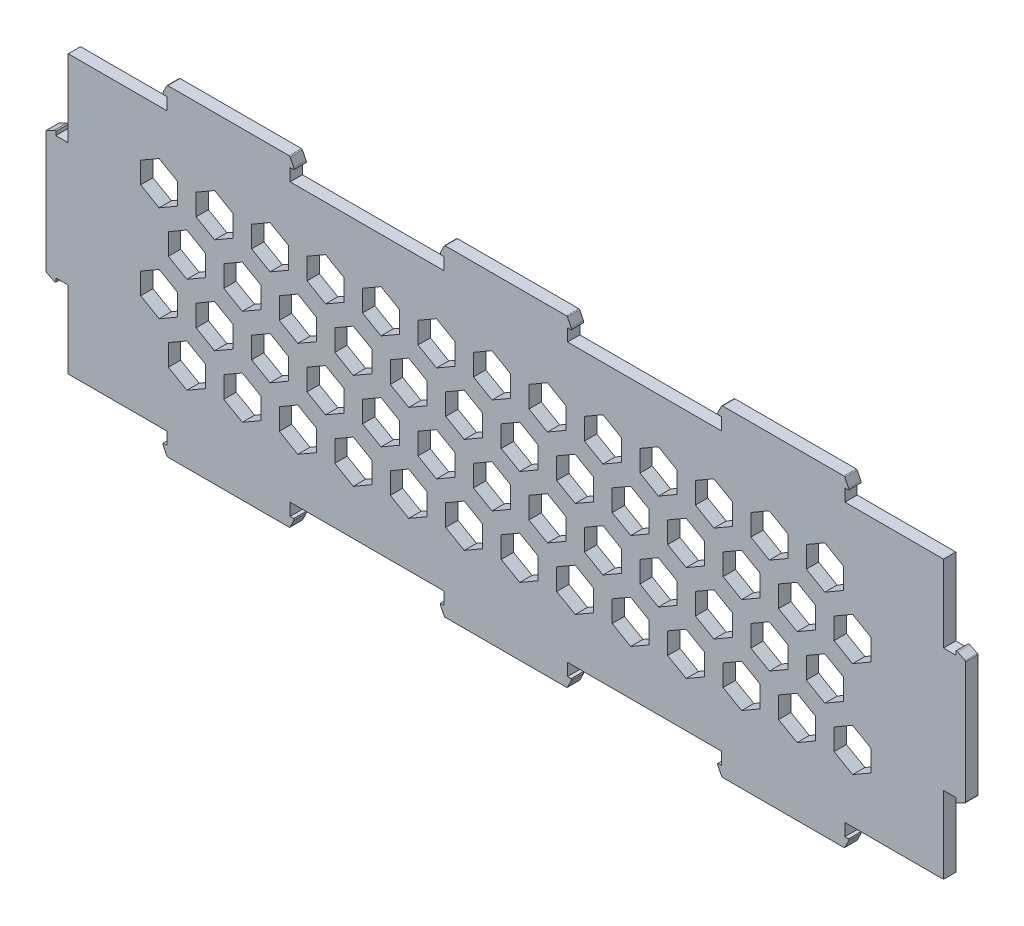
from build123d import *

# Parameters (mm, degrees)
BOSS_EXTRUDE1_DEPTH     = 2
ENL_V_MAT_EXTRU_1_DEPTH = 148.934343545


with BuildPart() as part:
    # Sketch1 → Boss-Extrude1 (new body)
    with BuildSketch(Plane.XY):
        with BuildLine():
            Line((0, 10), (0, 22.5))
            Line((0, 22.5), (16, 22.5))
            Line((16, 22.5), (16, 24.5))
            Line((16, 24.5), (15.4, 24.5))
            ThreePointArc((15.4, 24.5), (15.364589803, 24.65), (15.4, 24.8))
            Line((15.4, 24.8), (16, 26))
            ThreePointArc((16, 26), (16.066697747, 26.072982477), (16.161803399, 26.1))
            Line((16.161803399, 26.1), (35.838196601, 26.1))
            ThreePointArc((35.838196601, 26.1), (35.933302253, 26.072982477), (36, 26))
            Line((36, 26), (36.6, 24.8))
            ThreePointArc((36.6, 24.8), (36.635410197, 24.65), (36.6, 24.5))
            Line((36.6, 24.5), (36, 24.5))
            Line((36, 24.5), (36, 22.5))
            Line((36, 22.5), (61, 22.5))
            Line((61, 22.5), (61, 24.5))
            Line((61, 24.5), (60.4, 24.5))
            ThreePointArc((60.4, 24.5), (60.364589803, 24.65), (60.4, 24.8))
            Line((60.4, 24.8), (61, 26))
            ThreePointArc((61, 26), (61.066697747, 26.072982477), (61.161803399, 26.1))
            Line((61.161803399, 26.1), (80.838196601, 26.1))
            ThreePointArc((80.838196601, 26.1), (80.933302253, 26.072982477), (81, 26))
            Line((81, 26), (81.6, 24.8))
            ThreePointArc((81.6, 24.8), (81.635410197, 24.65), (81.6, 24.5))
            Line((81.6, 24.5), (81, 24.5))
            Line((81, 24.5), (81, 22.5))
            Line((81, 22.5), (106, 22.5))
            Line((106, 22.5), (106, 24.5))
            Line((106, 24.5), (105.4, 24.5))
            ThreePointArc((105.4, 24.5), (105.364589803, 24.65), (105.4, 24.8))
            Line((105.4, 24.8), (106, 26))
            ThreePointArc((106, 26), (106.066697747, 26.072982477), (106.161803399, 26.1))
            Line((106.161803399, 26.1), (125.838196601, 26.1))
            ThreePointArc((125.838196601, 26.1), (125.933302253, 26.072982477), (126, 26))
            Line((126, 26), (126.6, 24.8))
            ThreePointArc((126.6, 24.8), (126.635410197, 24.65), (126.6, 24.5))
            Line((126.6, 24.5), (126, 24.5))
            Line((126, 24.5), (126, 22.5))
            Line((126, 22.5), (142, 22.5))
            Line((142, 22.5), (142, 10))
            Line((142, 10), (144, 10))
            Line((144, 10), (144, 10.6))
            ThreePointArc((144, 10.6), (144.15, 10.635410197), (144.3, 10.6))
            Line((144.3, 10.6), (145.5, 10))
            ThreePointArc((145.5, 10), (145.572982477, 9.933302253), (145.6, 9.838196601))
            Line((145.6, 9.838196601), (145.6, -9.838196601))
            ThreePointArc((145.6, -9.838196601), (145.572982477, -9.933302253), (145.5, -10))
            Line((145.5, -10), (144.3, -10.6))
            ThreePointArc((144.3, -10.6), (144.15, -10.635410197), (144, -10.6))
            Line((144, -10.6), (144, -10))
            Line((144, -10), (142, -10))
            Line((142, -10), (142, -22.5))
            Line((142, -22.5), (126, -22.5))
            Line((126, -22.5), (126, -24.5))
            Line((126, -24.5), (126.6, -24.5))
            ThreePointArc((126.6, -24.5), (126.635410197, -24.65), (126.6, -24.8))
            Line((126.6, -24.8), (126, -26))
            ThreePointArc((126, -26), (125.933302253, -26.072982477), (125.838196601, -26.1))
            Line((125.838196601, -26.1), (106.161803399, -26.1))
            ThreePointArc((106.161803399, -26.1), (106.066697747, -26.072982477), (106, -26))
            Line((106, -26), (105.4, -24.8))
            ThreePointArc((105.4, -24.8), (105.364589803, -24.65), (105.4, -24.5))
            Line((105.4, -24.5), (106, -24.5))
            Line((106, -24.5), (106, -22.5))
            Line((106, -22.5), (81, -22.5))
            Line((81, -22.5), (81, -24.5))
            Line((81, -24.5), (81.6, -24.5))
            ThreePointArc((81.6, -24.5), (81.635410197, -24.65), (81.6, -24.8))
            Line((81.6, -24.8), (81, -26))
            ThreePointArc((81, -26), (80.933302253, -26.072982477), (80.838196601, -26.1))
            Line((80.838196601, -26.1), (61.161803399, -26.1))
            ThreePointArc((61.161803399, -26.1), (61.066697747, -26.072982477), (61, -26))
            Line((61, -26), (60.4, -24.8))
            ThreePointArc((60.4, -24.8), (60.364589803, -24.65), (60.4, -24.5))
            Line((60.4, -24.5), (61, -24.5))
            Line((61, -24.5), (61, -22.5))
            Line((61, -22.5), (36, -22.5))
            Line((36, -22.5), (36, -24.5))
            Line((36, -24.5), (36.6, -24.5))
            ThreePointArc((36.6, -24.5), (36.635410197, -24.65), (36.6, -24.8))
            Line((36.6, -24.8), (36, -26))
            ThreePointArc((36, -26), (35.933302253, -26.072982477), (35.838196601, -26.1))
            Line((35.838196601, -26.1), (16.161803399, -26.1))
            ThreePointArc((16.161803399, -26.1), (16.066697747, -26.072982477), (16, -26))
            Line((16, -26), (15.4, -24.8))
            ThreePointArc((15.4, -24.8), (15.364589803, -24.65), (15.4, -24.5))
            Line((15.4, -24.5), (16, -24.5))
            Line((16, -24.5), (16, -22.5))
            Line((16, -22.5), (0, -22.5))
            Line((0, -22.5), (0, -10))
            Line((0, -10), (-2, -10))
            Line((-2, -10), (-2, -10.6))
            ThreePointArc((-2, -10.6), (-2.15, -10.635410197), (-2.3, -10.6))
            Line((-2.3, -10.6), (-3.5, -10))
            ThreePointArc((-3.5, -10), (-3.572982477, -9.933302253), (-3.6, -9.838196601))
            Line((-3.6, -9.838196601), (-3.6, 9.838196601))
            ThreePointArc((-3.6, 9.838196601), (-3.572982477, 9.933302253), (-3.5, 10))
            Line((-3.5, 10), (-2.3, 10.6))
            ThreePointArc((-2.3, 10.6), (-2.15, 10.635410197), (-2, 10.6))
            Line((-2, 10.6), (-2, 10))
            Line((-2, 10), (0, 10))
        make_face()
    extrude(amount=BOSS_EXTRUDE1_DEPTH)

    # Esquisse1 → Enlèv. mat.-Extru.1 (cut, through all)
    with BuildSketch(Plane.XY.offset(2)):
        Polygon((11.75, 9.959292144), (14.75, 8.227241336), (17.75, 9.959292144), (17.75, 13.423393759), (14.75, 15.155444566), (11.75, 13.423393759), align=None)
        Polygon((22.25, 5.629165125), (19.25, 7.361215932), (16.25, 5.629165125), (16.25, 2.165063509), (19.25, 0.433012702), (22.25, 2.165063509), align=None)
        Polygon((20.75, 13.423393759), (20.75, 9.959292144), (23.75, 8.227241336), (26.75, 9.959292144), (26.75, 13.423393759), (23.75, 15.155444566), align=None)
        Polygon((31.25, 5.629165125), (28.25, 7.361215932), (25.25, 5.629165125), (25.25, 2.165063509), (28.25, 0.433012702), (31.25, 2.165063509), align=None)
        Polygon((35.75, 13.423393759), (32.75, 15.155444566), (29.75, 13.423393759), (29.75, 9.959292144), (32.75, 8.227241336), (35.75, 9.959292144), align=None)
        Polygon((40.25, 5.629165125), (37.25, 7.361215932), (34.25, 5.629165125), (34.25, 2.165063509), (37.25, 0.433012702), (40.25, 2.165063509), align=None)
        Polygon((44.75, 13.423393759), (41.75, 15.155444566), (38.75, 13.423393759), (38.75, 9.959292144), (41.75, 8.227241336), (44.75, 9.959292144), align=None)
        Polygon((47.75, 13.423393759), (47.75, 9.959292144), (50.75, 8.227241336), (53.75, 9.959292144), (53.75, 13.423393759), (50.75, 15.155444566), align=None)
        Polygon((58.25, 5.629165125), (55.25, 7.361215932), (52.25, 5.629165125), (52.25, 2.165063509), (55.25, 0.433012702), (58.25, 2.165063509), align=None)
        Polygon((62.75, 13.423393759), (59.75, 15.155444566), (56.75, 13.423393759), (56.75, 9.959292144), (59.75, 8.227241336), (62.75, 9.959292144), align=None)
        Polygon((67.25, 5.629165125), (64.25, 7.361215932), (61.25, 5.629165125), (61.25, 2.165063509), (64.25, 0.433012702), (67.25, 2.165063509), align=None)
        Polygon((71.75, 13.423393759), (68.75, 15.155444566), (65.75, 13.423393759), (65.75, 9.959292144), (68.75, 8.227241336), (71.75, 9.959292144), align=None)
        Polygon((43.25, 2.165063509), (46.25, 0.433012702), (49.25, 2.165063509), (49.25, 5.629165125), (46.25, 7.361215932), (43.25, 5.629165125), align=None)
        Polygon((11.75, -5.629165125), (14.75, -7.361215932), (17.75, -5.629165125), (17.75, -2.165063509), (14.75, -0.433012702), (11.75, -2.165063509), align=None)
        Polygon((22.25, -9.959292144), (19.25, -8.227241336), (16.25, -9.959292144), (16.25, -13.423393759), (19.25, -15.155444566), (22.25, -13.423393759), align=None)
        Polygon((20.75, -2.165063509), (20.75, -5.629165125), (23.75, -7.361215932), (26.75, -5.629165125), (26.75, -2.165063509), (23.75, -0.433012702), align=None)
        Polygon((31.25, -9.959292144), (28.25, -8.227241336), (25.25, -9.959292144), (25.25, -13.423393759), (28.25, -15.155444566), (31.25, -13.423393759), align=None)
        Polygon((35.75, -2.165063509), (32.75, -0.433012702), (29.75, -2.165063509), (29.75, -5.629165125), (32.75, -7.361215932), (35.75, -5.629165125), align=None)
        Polygon((40.25, -9.959292144), (37.25, -8.227241336), (34.25, -9.959292144), (34.25, -13.423393759), (37.25, -15.155444566), (40.25, -13.423393759), align=None)
        Polygon((44.75, -2.165063509), (41.75, -0.433012702), (38.75, -2.165063509), (38.75, -5.629165125), (41.75, -7.361215932), (44.75, -5.629165125), align=None)
        Polygon((47.75, -2.165063509), (47.75, -5.629165125), (50.75, -7.361215932), (53.75, -5.629165125), (53.75, -2.165063509), (50.75, -0.433012702), align=None)
        Polygon((58.25, -9.959292144), (55.25, -8.227241336), (52.25, -9.959292144), (52.25, -13.423393759), (55.25, -15.155444566), (58.25, -13.423393759), align=None)
        Polygon((62.75, -2.165063509), (59.75, -0.433012702), (56.75, -2.165063509), (56.75, -5.629165125), (59.75, -7.361215932), (62.75, -5.629165125), align=None)
        Polygon((67.25, -9.959292144), (64.25, -8.227241336), (61.25, -9.959292144), (61.25, -13.423393759), (64.25, -15.155444566), (67.25, -13.423393759), align=None)
        Polygon((71.75, -2.165063509), (68.75, -0.433012702), (65.75, -2.165063509), (65.75, -5.629165125), (68.75, -7.361215932), (71.75, -5.629165125), align=None)
        Polygon((43.25, -13.423393759), (46.25, -15.155444566), (49.25, -13.423393759), (49.25, -9.959292144), (46.25, -8.227241336), (43.25, -9.959292144), align=None)
        Polygon((130.25, -9.959292144), (127.25, -8.227241336), (124.25, -9.959292144), (124.25, -13.423393759), (127.25, -15.155444566), (130.25, -13.423393759), align=None)
        Polygon((119.75, -5.629165125), (122.75, -7.361215932), (125.75, -5.629165125), (125.75, -2.165063509), (122.75, -0.433012702), (119.75, -2.165063509), align=None)
        Polygon((121.25, -13.423393759), (121.25, -9.959292144), (118.25, -8.227241336), (115.25, -9.959292144), (115.25, -13.423393759), (118.25, -15.155444566), align=None)
        Polygon((110.75, -5.629165125), (113.75, -7.361215932), (116.75, -5.629165125), (116.75, -2.165063509), (113.75, -0.433012702), (110.75, -2.165063509), align=None)
        Polygon((106.25, -13.423393759), (109.25, -15.155444566), (112.25, -13.423393759), (112.25, -9.959292144), (109.25, -8.227241336), (106.25, -9.959292144), align=None)
        Polygon((101.75, -5.629165125), (104.75, -7.361215932), (107.75, -5.629165125), (107.75, -2.165063509), (104.75, -0.433012702), (101.75, -2.165063509), align=None)
        Polygon((97.25, -13.423393759), (100.25, -15.155444566), (103.25, -13.423393759), (103.25, -9.959292144), (100.25, -8.227241336), (97.25, -9.959292144), align=None)
        Polygon((94.25, -13.423393759), (94.25, -9.959292144), (91.25, -8.227241336), (88.25, -9.959292144), (88.25, -13.423393759), (91.25, -15.155444566), align=None)
        Polygon((83.75, -5.629165125), (86.75, -7.361215932), (89.75, -5.629165125), (89.75, -2.165063509), (86.75, -0.433012702), (83.75, -2.165063509), align=None)
        Polygon((79.25, -13.423393759), (82.25, -15.155444566), (85.25, -13.423393759), (85.25, -9.959292144), (82.25, -8.227241336), (79.25, -9.959292144), align=None)
        Polygon((74.75, -5.629165125), (77.75, -7.361215932), (80.75, -5.629165125), (80.75, -2.165063509), (77.75, -0.433012702), (74.75, -2.165063509), align=None)
        Polygon((70.25, -13.423393759), (73.25, -15.155444566), (76.25, -13.423393759), (76.25, -9.959292144), (73.25, -8.227241336), (70.25, -9.959292144), align=None)
        Polygon((98.75, -2.165063509), (95.75, -0.433012702), (92.75, -2.165063509), (92.75, -5.629165125), (95.75, -7.361215932), (98.75, -5.629165125), align=None)
        Polygon((130.25, 5.629165125), (127.25, 7.361215932), (124.25, 5.629165125), (124.25, 2.165063509), (127.25, 0.433012702), (130.25, 2.165063509), align=None)
        Polygon((119.75, 9.959292144), (122.75, 8.227241336), (125.75, 9.959292144), (125.75, 13.423393759), (122.75, 15.155444566), (119.75, 13.423393759), align=None)
        Polygon((121.25, 2.165063509), (121.25, 5.629165125), (118.25, 7.361215932), (115.25, 5.629165125), (115.25, 2.165063509), (118.25, 0.433012702), align=None)
        Polygon((110.75, 9.959292144), (113.75, 8.227241336), (116.75, 9.959292144), (116.75, 13.423393759), (113.75, 15.155444566), (110.75, 13.423393759), align=None)
        Polygon((106.25, 2.165063509), (109.25, 0.433012702), (112.25, 2.165063509), (112.25, 5.629165125), (109.25, 7.361215932), (106.25, 5.629165125), align=None)
        Polygon((101.75, 9.959292144), (104.75, 8.227241336), (107.75, 9.959292144), (107.75, 13.423393759), (104.75, 15.155444566), (101.75, 13.423393759), align=None)
        Polygon((97.25, 2.165063509), (100.25, 0.433012702), (103.25, 2.165063509), (103.25, 5.629165125), (100.25, 7.361215932), (97.25, 5.629165125), align=None)
        Polygon((94.25, 2.165063509), (94.25, 5.629165125), (91.25, 7.361215932), (88.25, 5.629165125), (88.25, 2.165063509), (91.25, 0.433012702), align=None)
        Polygon((83.75, 9.959292144), (86.75, 8.227241336), (89.75, 9.959292144), (89.75, 13.423393759), (86.75, 15.155444566), (83.75, 13.423393759), align=None)
        Polygon((79.25, 2.165063509), (82.25, 0.433012702), (85.25, 2.165063509), (85.25, 5.629165125), (82.25, 7.361215932), (79.25, 5.629165125), align=None)
        Polygon((74.75, 9.959292144), (77.75, 8.227241336), (80.75, 9.959292144), (80.75, 13.423393759), (77.75, 15.155444566), (74.75, 13.423393759), align=None)
        Polygon((70.25, 2.165063509), (73.25, 0.433012702), (76.25, 2.165063509), (76.25, 5.629165125), (73.25, 7.361215932), (70.25, 5.629165125), align=None)
        Polygon((98.75, 13.423393759), (95.75, 15.155444566), (92.75, 13.423393759), (92.75, 9.959292144), (95.75, 8.227241336), (98.75, 9.959292144), align=None)
    extrude(amount=-ENL_V_MAT_EXTRU_1_DEPTH, mode=Mode.SUBTRACT)


solid = part.part
